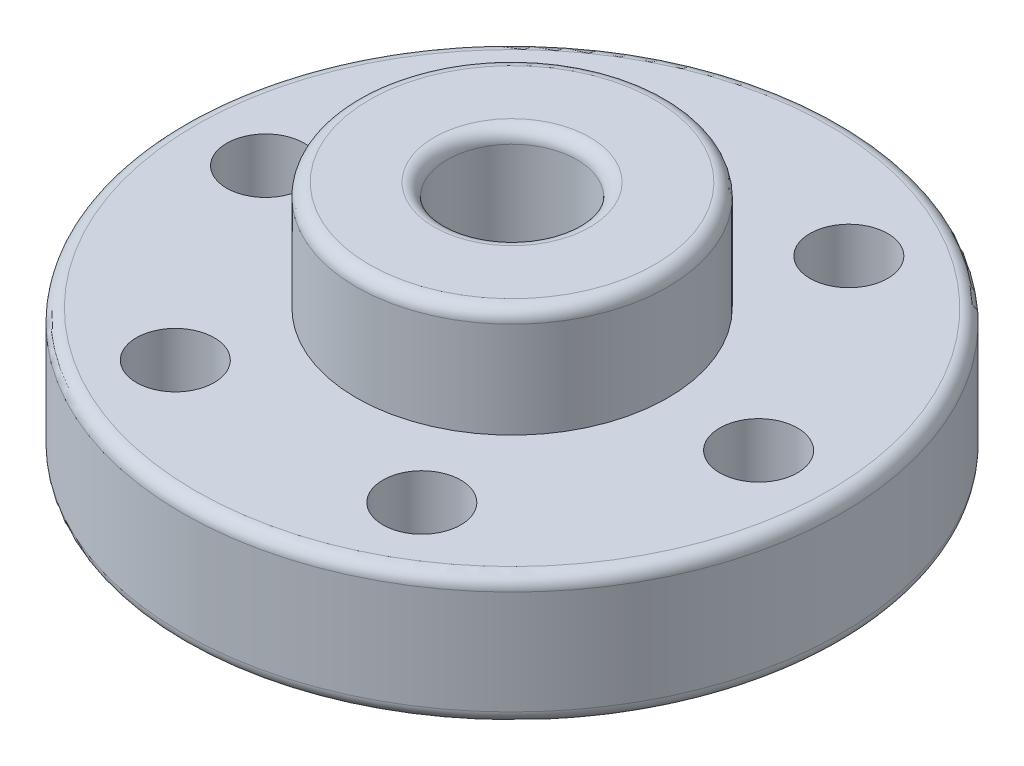
from build123d import *

# Parameters (mm, degrees)
SKETCH1_R        = 12.7
SKETCH1_R_2      = 1.5
SKETCH1_R_3      = 2.5
EXTRUSION1_DEPTH = 5
SKETCH2_R        = 6
SKETCH2_R_2      = 2.5
EXTRUSION2_DEPTH = 4.2
FILLET1_R        = 0.5


with BuildPart() as part:
    # Sketch1 → Extrusion1 (new body)
    with BuildSketch(Plane(origin=(0, 0, 0), x_dir=(-1, 0, 0), z_dir=(0, 1, 0))):
        with Locations(Location((0, 0, 0), (0, 0, 90))):
            Circle(SKETCH1_R)
        with Locations(Location((-4.75, -8.227241336, 0), (0, 0, 90))):
            Circle(SKETCH1_R_2, mode=Mode.SUBTRACT)
        with Locations(Location((0, 0, 0), (0, 0, 90))):
            Circle(SKETCH1_R_3, mode=Mode.SUBTRACT)
        with Locations(Location((-9.5, 0, 0), (0, 0, 90))):
            Circle(SKETCH1_R_2, mode=Mode.SUBTRACT)
        with Locations(Location((-4.75, 8.227241336, 0), (0, 0, 90))):
            Circle(SKETCH1_R_2, mode=Mode.SUBTRACT)
        with Locations(Location((4.75, 8.227241336, 0), (0, 0, 90))):
            Circle(SKETCH1_R_2, mode=Mode.SUBTRACT)
        with Locations(Location((9.5, 0, 0), (0, 0, 90))):
            Circle(SKETCH1_R_2, mode=Mode.SUBTRACT)
        with Locations(Location((4.75, -8.227241336, 0), (0, 0, 90))):
            Circle(SKETCH1_R_2, mode=Mode.SUBTRACT)
    extrude(amount=EXTRUSION1_DEPTH)

    # Sketch2 → Extrusion2 (add)
    with BuildSketch(Plane(origin=(0, 5, 0), x_dir=(1, 0, 0), z_dir=(0, 1, 0))):
        with Locations(Location((0, 0, 0), (0, 0, 270))):
            Circle(SKETCH2_R)
        with Locations(Location((0, 0, 0), (0, 0, 270))):
            Circle(SKETCH2_R_2, mode=Mode.SUBTRACT)
    extrude(amount=EXTRUSION2_DEPTH)

    # Fillet1
    fillet1_edges = [part.edges().sort_by_distance(p)[0] for p in [
        (0, 0, -12.7),
        (0, 0, -2.5),
        (0, 9.2, -2.5),
        (0, 9.2, -6),
        (0, 5, -12.7),
    ]]
    fillet(fillet1_edges, radius=FILLET1_R)


solid = part.part
